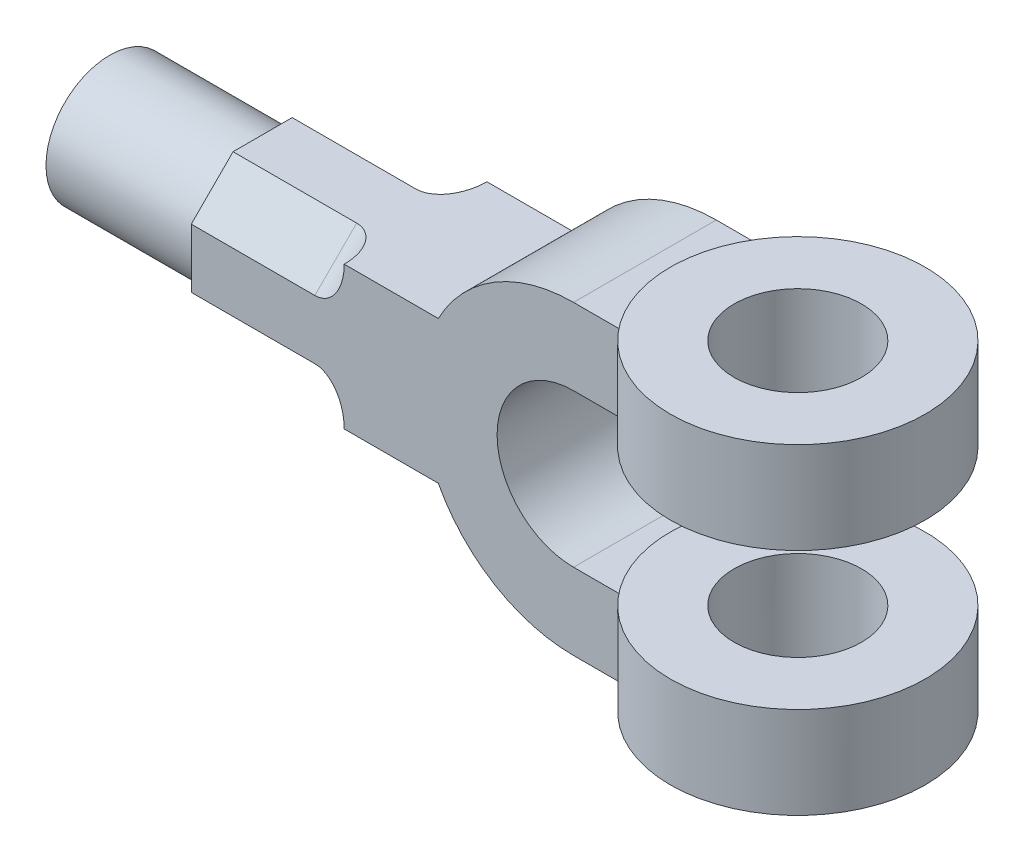
from build123d import *

# Parameters (mm, degrees)
SKETCH1_W             = 50
SKETCH1_H             = 18
BOSS_EXTRUDE1_DEPTH   = 25
BOSS_EXTRUDE1_2_DEPTH = 25
BOSS_EXTRUDE2_DEPTH   = 14
SKETCH1_5_W           = 18.467001677
SKETCH1_5_H           = 28
BOSS_EXTRUDE3_DEPTH   = 14
SKETCH2_R             = 12.5
CUT_EXTRUDE1_DEPTH    = 98
CUT_EXTRUDE2_DEPTH    = 98
BOSS_EXTRUDE4_DEPTH   = 15
BOSS_EXTRUDE5_DEPTH   = 15
BOSS_EXTRUDE6_DEPTH   = 30
FILLET1_R             = 5.75
FILLET2_R             = 5.75
FILLET3_R             = 5.75
FILLET4_R             = 5.75
SKETCH9_R             = 12.5
BOSS_EXTRUDE7_DEPTH   = 30


with BuildPart() as part:
    # Sketch1 → Boss-Extrude1 (new, symmetric)
    with BuildSketch(Plane.XY):
        with Locations((30, 22.5)):
            Rectangle(SKETCH1_W, SKETCH1_H)
    extrude(amount=BOSS_EXTRUDE1_DEPTH, both=True)



with BuildPart() as body_2:
    # Sketch1 → Boss-Extrude1 2 (new, symmetric)
    with BuildSketch(Plane.XY):
        with Locations((30, -22.5)):
            Rectangle(SKETCH1_W, SKETCH1_H)
    extrude(amount=BOSS_EXTRUDE1_2_DEPTH, both=True)


with BuildPart() as part_1:
    add(part.part)

    add(body_2.part)  # Boss-Extrude2 merges body 2
    # Sketch1<4> → Boss-Extrude2 (add, symmetric)
    with BuildSketch(Plane.XY):
        with BuildLine():
            Line((5, 15), (5, 30))
            Line((5, 30), (0, 30))
            ThreePointArc((0, 30), (-15.491933385, 25.690465157), (-26.532998323, 14))
            Line((-26.532998323, 14), (-26.532998323, -14))
            ThreePointArc((-26.532998323, -14), (-15.491933385, -25.690465157), (0, -30))
            Line((0, -30), (5, -30))
            Line((5, -30), (5, -15))
            Line((5, -15), (0, -15))
            ThreePointArc((0, -15), (-15, 0), (0, 15))
            Line((0, 15), (5, 15))
        make_face()
    extrude(amount=BOSS_EXTRUDE2_DEPTH, both=True)

    # Sketch1<5> → Boss-Extrude3 (add, symmetric)
    with BuildSketch(Plane.XY):
        with Locations((-35.766499162, 0)):
            Rectangle(SKETCH1_5_W, SKETCH1_5_H)
    extrude(amount=BOSS_EXTRUDE3_DEPTH, both=True)

    # Sketch2 → Cut-Extrude1 (cut)
    with BuildSketch(Plane(origin=(0, 31.5, 0), x_dir=(1, 0, 0), z_dir=(0, 1, 0))):
        with Locations((30, 0)):
            Circle(SKETCH2_R)
    extrude(amount=-CUT_EXTRUDE1_DEPTH, mode=Mode.SUBTRACT)

    # Sketch3 → Cut-Extrude2 (cut)
    with BuildSketch(Plane(origin=(0, 31.5, 0), x_dir=(1, 0, 0), z_dir=(0, 1, 0))):
        with BuildLine():
            Line((5, -2.5e-08), (5, -25))
            Line((5, -25), (30, -25))
            ThreePointArc((30, -25), (12.322330479, -17.677669538), (5, -2.5e-08))
        make_face()
        with BuildLine():
            Line((5, 25), (5, -2.5e-08))
            ThreePointArc((5, -2.5e-08), (12.322330462, 17.677669521), (30, 25))
            Line((30, 25), (5, 25))
        make_face()
        with BuildLine():
            ThreePointArc((55, 0), (47.67766953, -17.67766953), (30, -25))
            Line((30, -25), (55, -25))
            Line((55, -25), (55, 0))
        make_face()
        with BuildLine():
            Line((55, 25), (30, 25))
            ThreePointArc((30, 25), (47.67766953, 17.67766953), (55, 0))
            Line((55, 0), (55, 25))
        make_face()
    extrude(amount=-CUT_EXTRUDE2_DEPTH, mode=Mode.SUBTRACT)


with BuildPart() as cut_extrude2_piece_1:
    # of the separate pieces the step leaves, piece 1, a body of its own (cut_extrude2_pieces)
    add(part_1.part.solids().sort_by_distance((5, -15, -14))[0])



with BuildPart() as cut_extrude2_piece_2:
    # of the separate pieces the step leaves, piece 2, a body of its own (cut_extrude2_pieces)
    add(part_1.part.solids().sort_by_distance((30, -13.5, -25))[0])


with BuildPart() as cut_extrude2_piece_3:
    # of the separate pieces the step leaves, piece 3, a body of its own (cut_extrude2_pieces)
    add(part_1.part.solids().sort_by_distance((5, 31.5, 2.5e-08))[0])


with BuildPart() as cut_extrude2_piece_1_1:
    add(cut_extrude2_piece_1.part)

    add(cut_extrude2_piece_3.part)  # Boss-Extrude4 merges Cut-Extrude2 piece 3
    # Sketch6 → Boss-Extrude4 (add)
    with BuildSketch(Plane(origin=(0, 30, 0), x_dir=(1, 0, 0), z_dir=(0, 1, 0))):
        with BuildLine():
            ThreePointArc((9.287684823, -14), (6.095943024, -7.320933008), (5, 2.6e-08))
            Line((5, 2.6e-08), (5, -14))
            Line((5, -14), (9.287684823, -14))
        make_face()
        with BuildLine():
            Line((9.287684823, 14), (5, 14))
            Line((5, 14), (5, 2.6e-08))
            ThreePointArc((5, 2.6e-08), (6.095943032, 7.320933033), (9.287684823, 14))
        make_face()
    extrude(amount=-BOSS_EXTRUDE4_DEPTH)


    add(cut_extrude2_piece_2.part)  # Boss-Extrude5 merges Cut-Extrude2 piece 2
    # Sketch7 → Boss-Extrude5 (add)
    with BuildSketch(Plane(origin=(0, -30, 0), x_dir=(-1, 0, 0), z_dir=(0, -1, 0))):
        with BuildLine():
            Line((-5, 0), (-5, 14))
            Line((-5, 14), (-9.287684823, 14))
            ThreePointArc((-9.287684823, 14), (-6.095943028, 7.32093302), (-5, 0))
        make_face()
        with BuildLine():
            Line((-5, -14), (-5, 0))
            ThreePointArc((-5, 0), (-6.095943028, -7.32093302), (-9.287684823, -14))
            Line((-9.287684823, -14), (-5, -14))
        make_face()
    extrude(amount=-BOSS_EXTRUDE5_DEPTH)

    # Sketch8 → Boss-Extrude6 (add)
    with BuildSketch(Plane.ZY.offset(45)):
        Polygon((5.798989873, 14), (-5.798989873, 14), (-14, 5.798989873), (-14, -5.798989873), (-5.798989873, -14), (5.798989873, -14), (14, -5.798989873), (14, 5.798989873), align=None)
    extrude(amount=BOSS_EXTRUDE6_DEPTH)

    # Fillet1
    fillet1_edges = [cut_extrude2_piece_1_1.edges().sort_by_distance(p)[0] for p in [
        (-45, 9.899494937, -9.899494937),
    ]]
    fillet(fillet1_edges, radius=FILLET1_R)

    # Fillet2
    fillet2_edges = [cut_extrude2_piece_1_1.edges().sort_by_distance(p)[0] for p in [
        (-45, 9.899494937, 9.899494937),
    ]]
    fillet(fillet2_edges, radius=FILLET2_R)

    # Fillet3
    fillet3_edges = [cut_extrude2_piece_1_1.edges().sort_by_distance(p)[0] for p in [
        (-45, -9.899494937, -9.899494937),
    ]]
    fillet(fillet3_edges, radius=FILLET3_R)

    # Fillet4
    fillet4_edges = [cut_extrude2_piece_1_1.edges().sort_by_distance(p)[0] for p in [
        (-45, -9.899494937, 9.899494937),
    ]]
    fillet(fillet4_edges, radius=FILLET4_R)

    # Sketch9 → Boss-Extrude7 (add)
    with BuildSketch(Plane.ZY.offset(75)):
        Circle(SKETCH9_R)
    extrude(amount=BOSS_EXTRUDE7_DEPTH)


solid = cut_extrude2_piece_1_1.part
